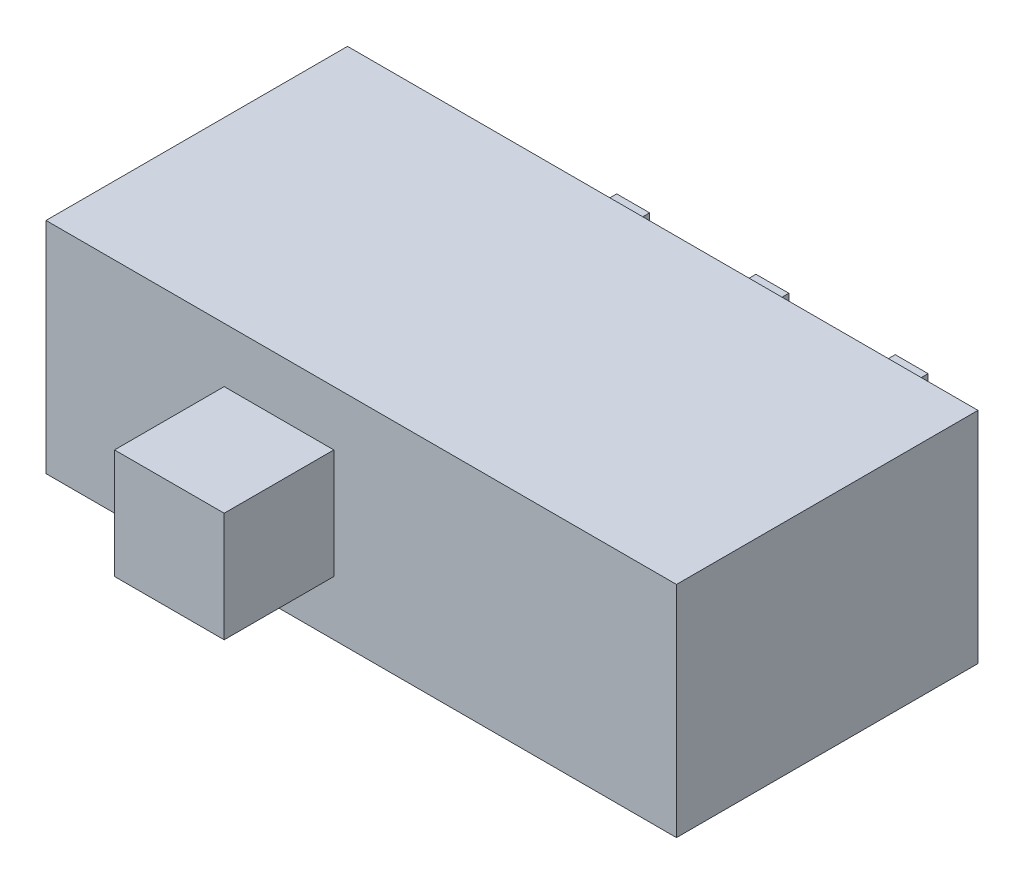
from build123d import *

# Parameters (mm, degrees)
SKETCH1_W           = 11.5
SKETCH1_H           = 5.5
BOSS_EXTRUDE1_DEPTH = 2
SKETCH3_W           = 2
SKETCH3_H           = 2
BOSS_EXTRUDE2_DEPTH = 2
SKETCH5_W           = 0.6
SKETCH5_H           = 0.25
BOSS_EXTRUDE3_DEPTH = 2


with BuildPart() as part:
    # Sketch1 → Boss-Extrude1 (new, symmetric)
    with BuildSketch(Plane(origin=(0, 0, 0), x_dir=(1, 0, 0), z_dir=(0, 1, 0))):
        Rectangle(SKETCH1_W, SKETCH1_H)
    extrude(amount=BOSS_EXTRUDE1_DEPTH, both=True)

    # Sketch3 → Boss-Extrude2 (add)
    with BuildSketch(Plane.XY.offset(2.75)):
        with Locations((-1.5, 0)):
            Rectangle(SKETCH3_W, SKETCH3_H)
    extrude(amount=BOSS_EXTRUDE2_DEPTH)

    # Sketch5 → Boss-Extrude3 (add)
    with BuildSketch(Plane(origin=(0, 0, -2.75), x_dir=(-1, 0, 0), z_dir=(0, 0, -1))):
        with Locations((-2.54, 0)):
            Rectangle(SKETCH5_W, SKETCH5_H)
        Rectangle(SKETCH5_W, SKETCH5_H)
        with Locations((2.54, 0)):
            Rectangle(SKETCH5_W, SKETCH5_H)
    extrude(amount=BOSS_EXTRUDE3_DEPTH)


solid = part.part
